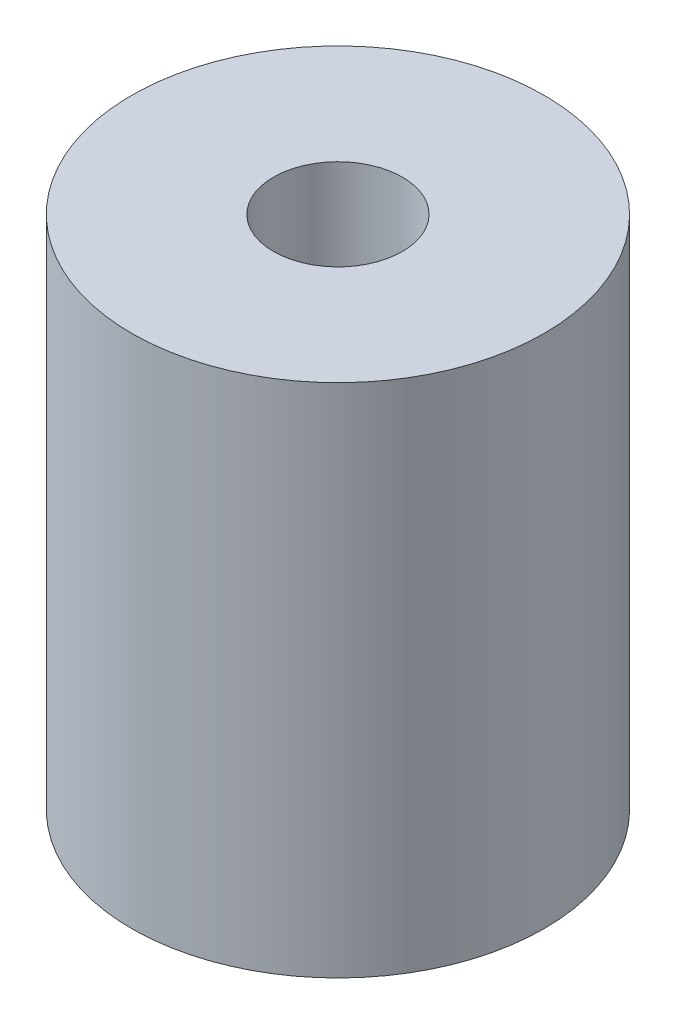
from build123d import *

# Parameters (mm, degrees)
SKETCH_1_R          = 6
EXTRUDE_1_DEPTH     = 40
SKETCH_2_R          = 5
CUT_EXTRUDE_2_DEPTH = 30
SKETCH_3_R          = 2.5
CUT_EXTRUDE_4_DEPTH = 10
SKETCH_5_R          = 16
SKETCH_5_R_2        = 6
EXTRUDE_1_2_DEPTH   = 40


with BuildPart() as part:
    # 草圖1 → Extrude 1 (new body)
    with BuildSketch(Plane(origin=(0, 0, 0), x_dir=(1, 0, 0), z_dir=(0, 1, 0))):
        with Locations(Location((0, 0, 0), (0, 0, 270))):
            Circle(SKETCH_1_R)
    extrude(amount=EXTRUDE_1_DEPTH)

    # 草圖2 → 除料-伸長2 (cut)
    with BuildSketch(Plane(origin=(0, 40, 0), x_dir=(1, 0, 0), z_dir=(0, 1, 0))):
        with Locations(Location((0, 0, 0), (0, 0, 270))):
            Circle(SKETCH_2_R)
    extrude(amount=-CUT_EXTRUDE_2_DEPTH, mode=Mode.SUBTRACT)

    # 草圖3 → 除料-伸長4 (cut)
    with BuildSketch(Plane.XZ):
        with Locations(Location((0, 0, 0), (0, 0, 270))):
            Circle(SKETCH_3_R)
    extrude(amount=-CUT_EXTRUDE_4_DEPTH, mode=Mode.SUBTRACT)

    # 草圖5 → Extrude 1 2 (add)
    with BuildSketch(Plane(origin=(0, 0, 0), x_dir=(1, 0, 0), z_dir=(0, 1, 0))):
        Circle(SKETCH_5_R)
        Circle(SKETCH_5_R_2, mode=Mode.SUBTRACT)
    extrude(amount=EXTRUDE_1_2_DEPTH)


solid = part.part
